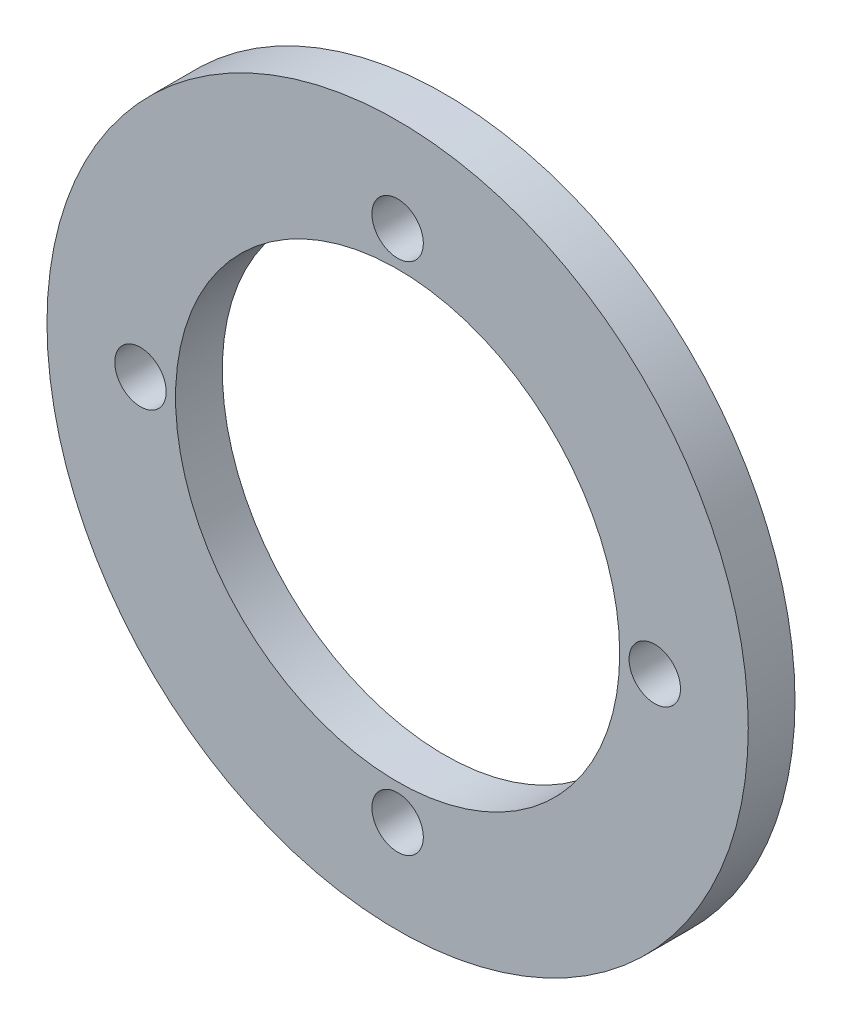
from build123d import *

# Parameters (mm, degrees)
SKETCH_1_R          = 15
SKETCH_1_R_2        = 9.5
EXTRUDE_1_DEPTH     = 2
SKETCH_2_R          = 1.1
CUT_EXTRUDE_1_DEPTH = 2


with BuildPart() as part:
    # 草图1 → 凸台-拉伸1 (new body)
    with BuildSketch(Plane.XY):
        Circle(SKETCH_1_R)
        Circle(SKETCH_1_R_2, mode=Mode.SUBTRACT)
    extrude(amount=EXTRUDE_1_DEPTH)

    # 草图2 → 切除-拉伸1 (cut)
    with BuildSketch(Plane.XY.offset(2)):
        with Locations((0, 11)):
            Circle(SKETCH_2_R)
        with Locations((11, 0)):
            Circle(SKETCH_2_R)
        with Locations((0, -11)):
            Circle(SKETCH_2_R)
        with Locations((-11, 0)):
            Circle(SKETCH_2_R)
    extrude(amount=-CUT_EXTRUDE_1_DEPTH, mode=Mode.SUBTRACT)


solid = part.part
